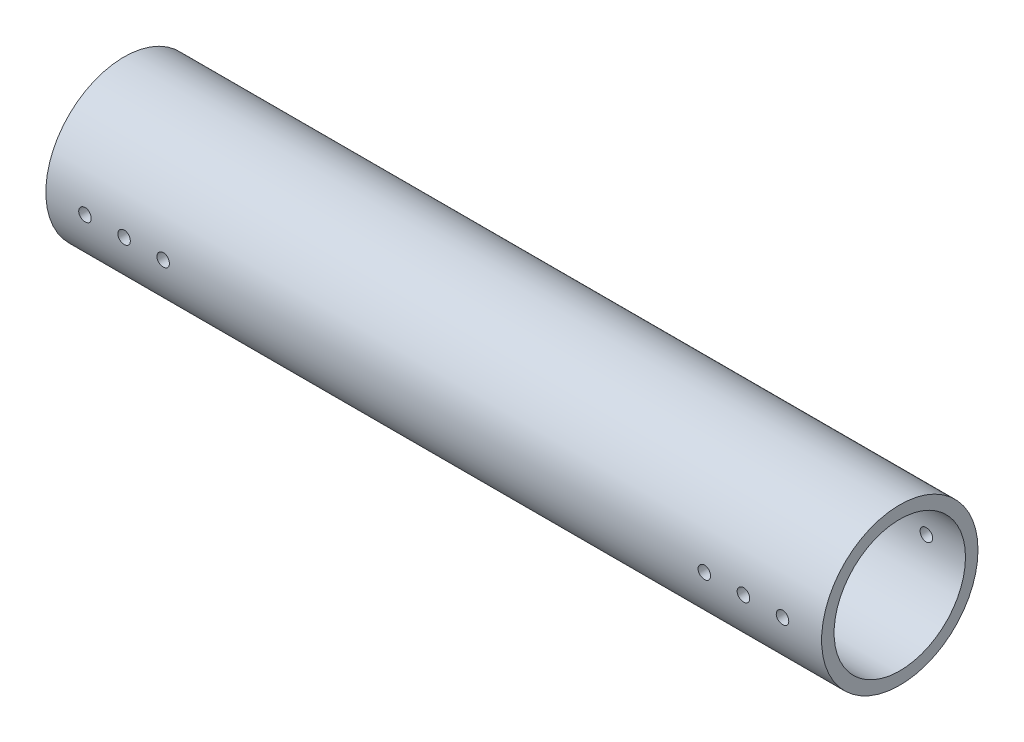
from build123d import *

# Parameters (mm, degrees)
SKETCH_2_R               = 25
SKETCH_2_R_2             = 21
EXTRUDE_2_DEPTH          = 248
CUT_EXTRUDE_2_DEPTH      = 10
CUT_EXTRUDE_2_DEPTH_BACK = 255.222343629
SKETCH_4_R               = 2


with BuildPart() as part:
    # Эскиз2 → Бобышка-Вытянуть2 (new body)
    with BuildSketch(Plane(origin=(0, 0, 0), x_dir=(0, 0, -1), z_dir=(1, 0, 0))):
        Circle(SKETCH_2_R)
        Circle(SKETCH_2_R_2, mode=Mode.SUBTRACT)
    extrude(amount=EXTRUDE_2_DEPTH)

    # Эскиз4 → Вырез-Вытянуть2 (cut, two sides: drawn at the far end of the back side and taken through both)
    with BuildSketch(Plane.XY.offset(25).offset(-CUT_EXTRUDE_2_DEPTH_BACK)):
        with Locations((12.5, 0)):
            Circle(SKETCH_4_R)
        with Locations((235.5, 0)):
            Circle(SKETCH_4_R)
        with Locations((25, 0)):
            Circle(SKETCH_4_R)
        with Locations((37.5, 0)):
            Circle(SKETCH_4_R)
        with Locations((223, 0)):
            Circle(SKETCH_4_R)
        with Locations((210.5, 0)):
            Circle(SKETCH_4_R)
    extrude(amount=CUT_EXTRUDE_2_DEPTH + CUT_EXTRUDE_2_DEPTH_BACK, mode=Mode.SUBTRACT)


solid = part.part
